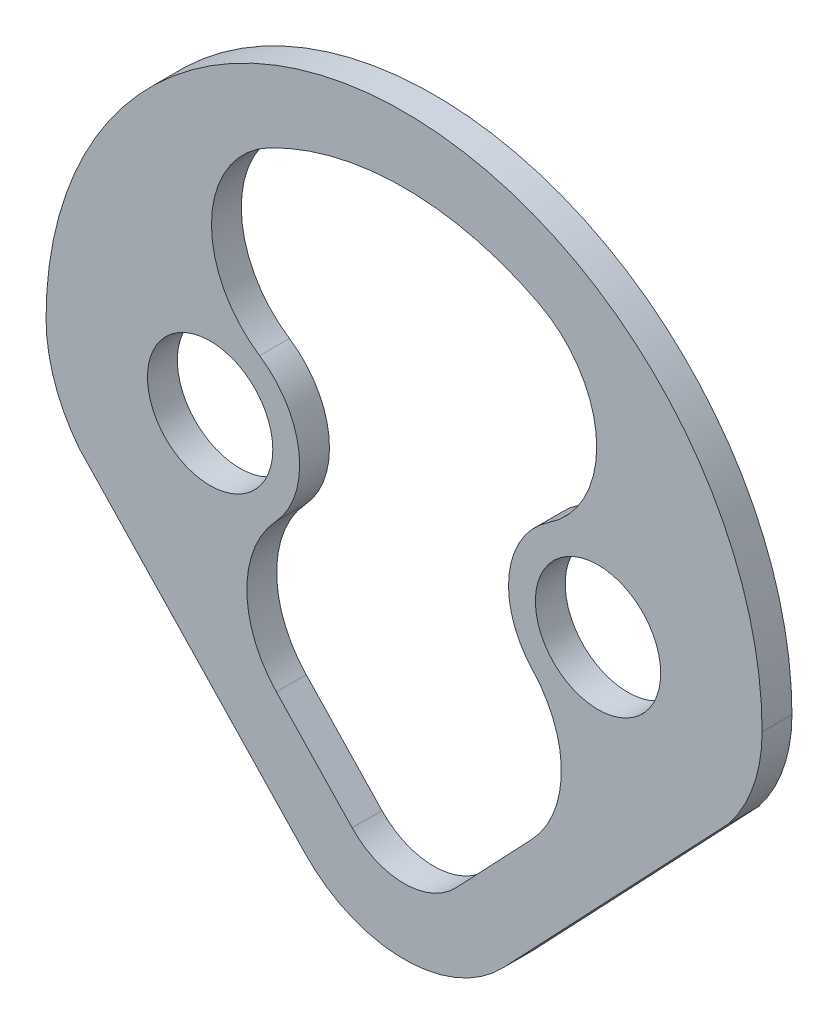
from build123d import *

# Parameters (mm, degrees)
SKETCH1_R           = 10.5
BOSS_EXTRUDE1_DEPTH = 5


with BuildPart() as part:
    # Sketch1 → Boss-Extrude1 (new body)
    with BuildSketch(Plane.XY):
        with BuildLine():
            ThreePointArc((-60, 40), (-58.56615935, 31.485082808), (-54.422783478, 23.909322108))
            Line((-54.422783478, 23.909322108), (-16.678178701, -15.837877232))
            ThreePointArc((-16.678178701, -15.837877232), (0, -23), (16.678178701, -15.837877232))
            Line((16.678178701, -15.837877232), (54.422783478, 23.909322108))
            ThreePointArc((54.422783478, 23.909322108), (58.56615935, 31.485082808), (60, 40))
            ThreePointArc((60, 40), (0, 100), (-60, 40))
        make_face()
        with Locations((-32.5, 40)):
            Circle(SKETCH1_R, mode=Mode.SUBTRACT)
        with BuildLine():
            Line((-8.701658453, -8.263240295), (-21.404458824, 5.113525511))
            ThreePointArc((-21.404458824, 5.113525511), (-26.35176104, 17.421416266), (-21.523623248, 29.77653907))
            ThreePointArc((-21.523623248, 29.77653907), (-17.604326655, 41.766045188), (-24.218531469, 52.506689369))
            ThreePointArc((-24.218531469, 52.506689369), (-32.255432897, 68.469423949), (-22.572828784, 83.491003675))
            ThreePointArc((-22.572828784, 83.491003675), (0, 89), (22.572828784, 83.491003675))
            ThreePointArc((22.572828784, 83.491003675), (32.255432897, 68.469423949), (24.218531469, 52.506689369))
            ThreePointArc((24.218531469, 52.506689369), (17.604326655, 41.766045188), (21.523623248, 29.77653907))
            ThreePointArc((21.523623248, 29.77653907), (26.35176104, 17.421416266), (21.404458824, 5.113525511))
            Line((21.404458824, 5.113525511), (8.701658453, -8.263240295))
            ThreePointArc((8.701658453, -8.263240295), (0, -12), (-8.701658453, -8.263240295))
        make_face(mode=Mode.SUBTRACT)
        with Locations((32.5, 40)):
            Circle(SKETCH1_R, mode=Mode.SUBTRACT)
    extrude(amount=BOSS_EXTRUDE1_DEPTH)


solid = part.part
